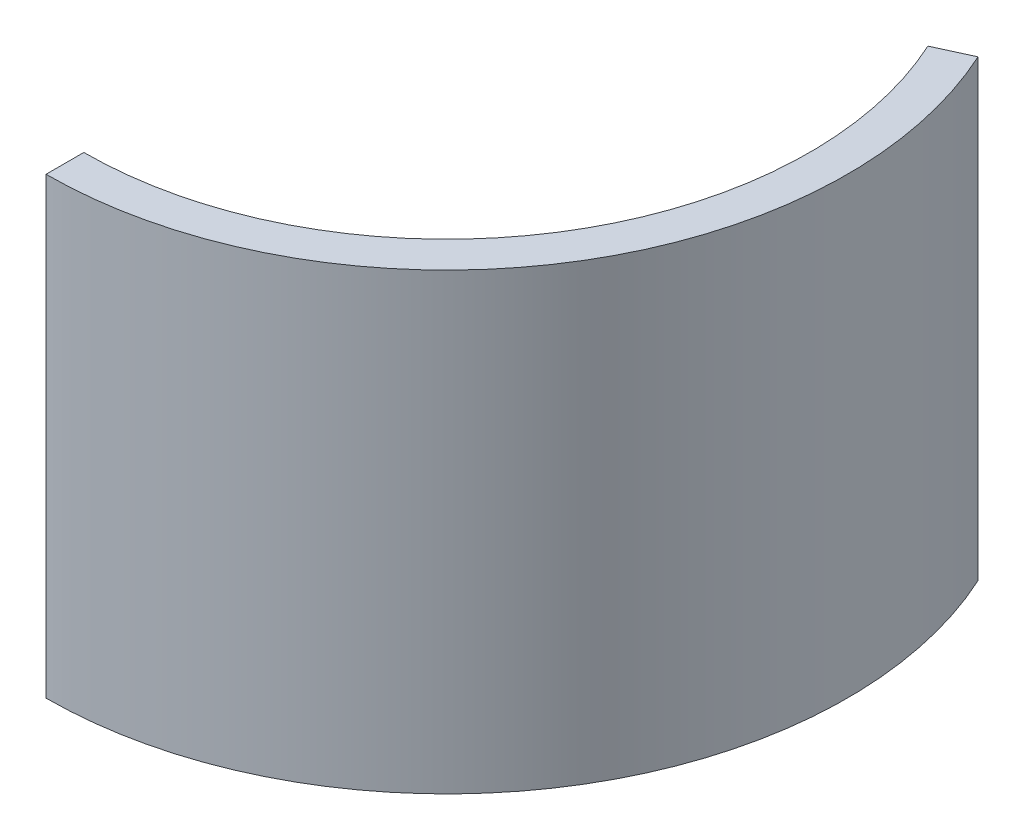
from build123d import *

# Parameters (mm, degrees)
EXTRUDE_1_DEPTH = 30


with BuildPart() as part:
    # 草图1 → 凸台-拉伸1 (new body)
    with BuildSketch(Plane(origin=(0, 0, 0), x_dir=(1, 0, 0), z_dir=(0, 1, 0))):
        with BuildLine():
            Line((0, -24), (0, -26.5))
            ThreePointArc((0, -26.5), (22.303073406, -14.311635709), (24.090072586, 11.041666667))
            Line((24.090072586, 11.041666667), (21.817424229, 10))
            ThreePointArc((21.817424229, 10), (20.199009877, -12.961481397), (0, -24))
        make_face()
    extrude(amount=EXTRUDE_1_DEPTH)


solid = part.part
